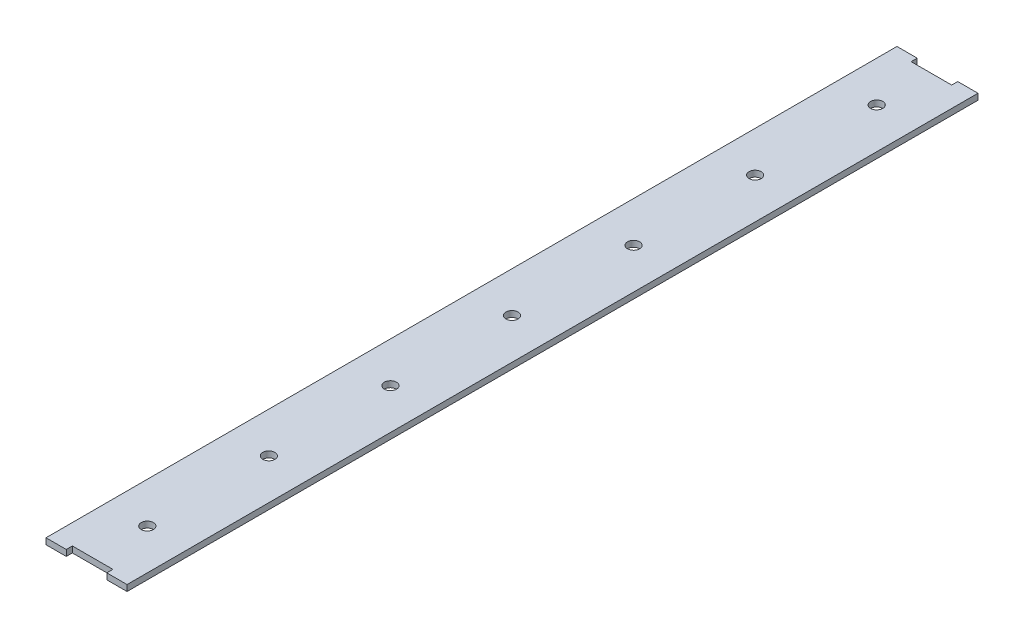
from build123d import *

# Parameters (mm, degrees)
SKETCH1_R           = 3
BOSS_EXTRUDE1_DEPTH = 3


with BuildPart() as part:
    # Sketch1 → Boss-Extrude1 (new body)
    with BuildSketch(Plane(origin=(0, 0, 0), x_dir=(1, 0, 0), z_dir=(0, 1, 0))):
        Polygon((-20, 420), (-20, 0), (-10, 0), (-10, 3), (10, 3), (10, 0), (20, 0), (20, 420), (10, 420), (10, 417), (-10, 417), (-10, 420), align=None)
        with Locations(Location((0, 90, 0), (0, 0, 270))):
            Circle(SKETCH1_R, mode=Mode.SUBTRACT)
        with Locations(Location((0, 150, 0), (0, 0, 270))):
            Circle(SKETCH1_R, mode=Mode.SUBTRACT)
        with Locations(Location((0, 30, 0), (0, 0, 270))):
            Circle(SKETCH1_R, mode=Mode.SUBTRACT)
        with Locations(Location((0, 210, 0), (0, 0, 270))):
            Circle(SKETCH1_R, mode=Mode.SUBTRACT)
        with Locations(Location((0, 270, 0), (0, 0, 270))):
            Circle(SKETCH1_R, mode=Mode.SUBTRACT)
        with Locations(Location((0, 330, 0), (0, 0, 270))):
            Circle(SKETCH1_R, mode=Mode.SUBTRACT)
        with Locations(Location((0, 390, 0), (0, 0, 270))):
            Circle(SKETCH1_R, mode=Mode.SUBTRACT)
    extrude(amount=BOSS_EXTRUDE1_DEPTH)


solid = part.part
